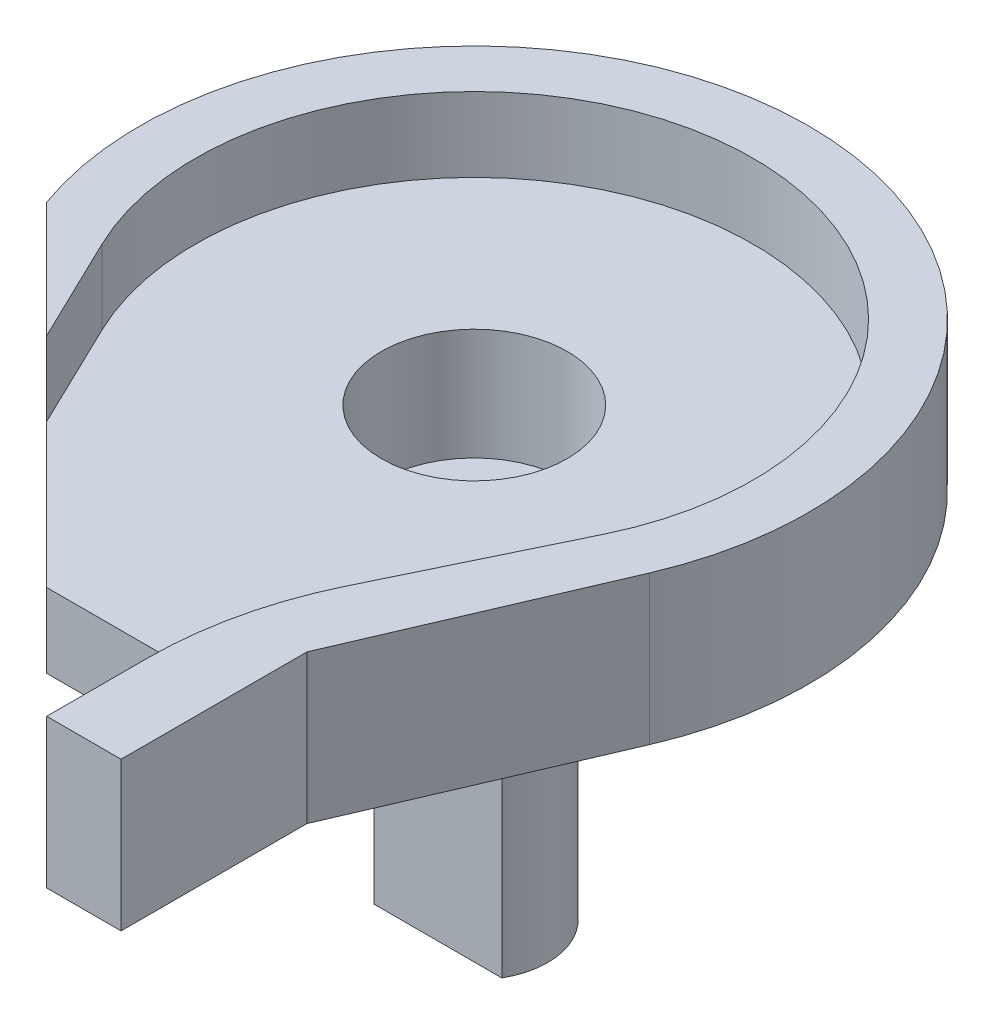
from build123d import *

# Parameters (mm, degrees)
BOSS_EXTRUDE1_DEPTH = 4
CUT_EXTRUDE1_DEPTH  = 2
BOSS_EXTRUDE2_DEPTH = 10
SKETCH4_R           = 3
BOSS_EXTRUDE3_DEPTH = 4
SKETCH5_R           = 2.5
CUT_EXTRUDE2_DEPTH  = 3
CHAMFER1_SIZE       = 1
SKETCH6_W           = 2
SKETCH6_H           = 4
BOSS_EXTRUDE4_DEPTH = 5
FILLET1_R           = 10
CUT_EXTRUDE3_DEPTH  = 10


with BuildPart() as part:
    # Sketch1 → Boss-Extrude1 (new body)
    with BuildSketch(Plane(origin=(0, 0, 0), x_dir=(1, 0, 0), z_dir=(0, 1, 0))):
        with BuildLine():
            Line((-8.269520907, -3.551763501), (-5.5, -10))
            Line((-5.5, -10), (5.5, -10))
            Line((5.5, -10), (8.269520907, -3.551763501))
            ThreePointArc((8.269520907, -3.551763501), (0, 9), (-8.269520907, -3.551763501))
        make_face()
    extrude(amount=BOSS_EXTRUDE1_DEPTH)

    # Sketch2 → Cut-Extrude1 (cut)
    with BuildSketch(Plane(origin=(0, 4, 0), x_dir=(1, 0, 0), z_dir=(0, 1, 0))):
        with BuildLine():
            Line((-6.753885149, -3.261140198), (-3.5, -10))
            Line((-3.5, -10), (3.5, -10))
            Line((3.5, -10), (6.753885149, -3.261140198))
            ThreePointArc((6.753885149, -3.261140198), (0, 7.5), (-6.753885149, -3.261140198))
        make_face()
    extrude(amount=-CUT_EXTRUDE1_DEPTH, mode=Mode.SUBTRACT)

    # Sketch3 → Boss-Extrude2 (add)
    with BuildSketch(Plane.XZ):
        with BuildLine():
            Line((-1.717556404, 0.975), (1.717556404, 0.975))
            ThreePointArc((1.717556404, 0.975), (0, -1.975), (-1.717556404, 0.975))
        make_face()
    extrude(amount=BOSS_EXTRUDE2_DEPTH)

    # Sketch4 → Boss-Extrude3 (add)
    with BuildSketch(Plane.XZ):
        with Locations(Location((0, 0, 0), (0, 0, 90))):
            Circle(SKETCH4_R)
    extrude(amount=BOSS_EXTRUDE3_DEPTH)

    # Sketch5 → Cut-Extrude2 (cut)
    with BuildSketch(Plane(origin=(0, 2, 0), x_dir=(1, 0, 0), z_dir=(0, 1, 0))):
        with Locations(Location((0, 0, 0), (0, 0, 270))):
            Circle(SKETCH5_R)
    extrude(amount=-CUT_EXTRUDE2_DEPTH, mode=Mode.SUBTRACT)

    # Chamfer1
    chamfer1_edges = [part.edges().sort_by_distance(p)[0] for p in [
        (0, 0, -3),
        (0, -4, -3),
    ]]
    chamfer(chamfer1_edges, length=CHAMFER1_SIZE)

    # Sketch6 → Boss-Extrude4 (add)
    with BuildSketch(Plane.XY.offset(10)):
        with Locations((4.5, 2)):
            Rectangle(SKETCH6_W, SKETCH6_H)
    extrude(amount=BOSS_EXTRUDE4_DEPTH)

    # Fillet1
    fillet1_edges = [part.edges().sort_by_distance(p)[0] for p in [
        (3.5, 3, 10),
    ]]
    fillet(fillet1_edges, radius=FILLET1_R)

    # Sketch8 → Cut-Extrude3 (cut)
    with BuildSketch(Plane.XZ):
        Polygon((-5.5, 10), (-1.5, 10), (-8.511399863, 2.988600137), align=None)
    extrude(amount=-CUT_EXTRUDE3_DEPTH, mode=Mode.SUBTRACT)


solid = part.part
